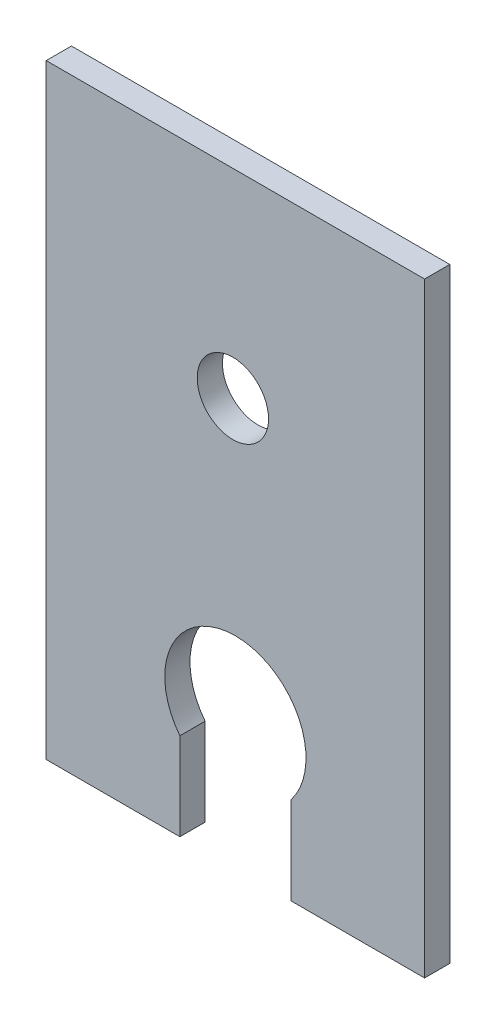
from build123d import *

# Parameters (mm, degrees)
ESQUISSE1_W             = 150
ESQUISSE1_H             = 240
BASE_EXTRUSION_DEPTH    = 10
ENL_V_MAT_EXTRU_1_DEPTH = 10
ESQUISSE3_R             = 14.142135624
ENL_V_MAT_EXTRU_2_DEPTH = 10


with BuildPart() as part:
    # Esquisse1 → Base-Extrusion (new body)
    with BuildSketch(Plane.XY):
        with Locations((75, 120)):
            Rectangle(ESQUISSE1_W, ESQUISSE1_H)
    extrude(amount=BASE_EXTRUSION_DEPTH)

    # Esquisse2 → Enlèv. mat.-Extru.1 (cut)
    with BuildSketch(Plane.XY.offset(10)):
        with BuildLine():
            Line((53, 0), (97, 0))
            Line((97, 0), (97, 34.679491924))
            ThreePointArc((97, 34.679491924), (75, 80), (53, 34.679491924))
            Line((53, 34.679491924), (53, 0))
        make_face()
    extrude(amount=-ENL_V_MAT_EXTRU_1_DEPTH, mode=Mode.SUBTRACT)

    # Esquisse3 → Enlèv. mat.-Extru.2 (cut)
    with BuildSketch(Plane.XY.offset(10)):
        with Locations((74, 161)):
            Circle(ESQUISSE3_R)
    extrude(amount=-ENL_V_MAT_EXTRU_2_DEPTH, mode=Mode.SUBTRACT)


solid = part.part
